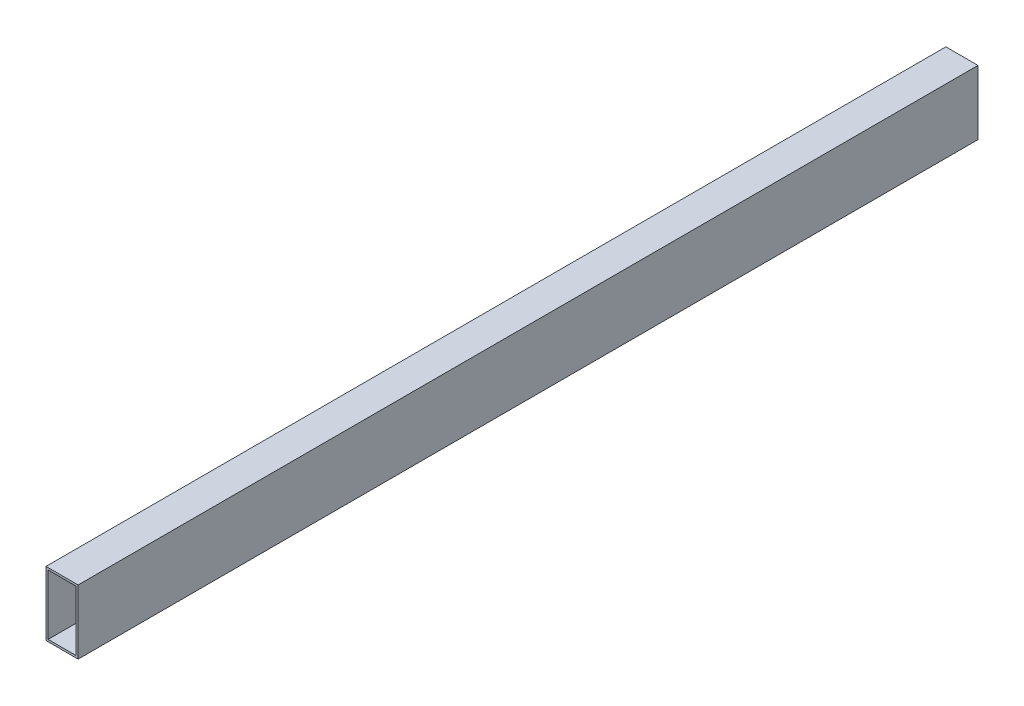
from build123d import *

# Parameters (mm, degrees)
SKETCH1_W           = 25.4
SKETCH1_H           = 50.8
BOSS_EXTRUDE1_DEPTH = 711.2
SKETCH2_W           = 22.098
SKETCH2_H           = 47.498
CUT_EXTRUDE1_DEPTH  = 714.486936201


with BuildPart() as part:
    # Sketch1 → Boss-Extrude1 (new body)
    with BuildSketch(Plane.XY):
        with Locations((-35.737209302, -4.799418605)):
            Rectangle(SKETCH1_W, SKETCH1_H)
    extrude(amount=BOSS_EXTRUDE1_DEPTH)

    # Sketch2 → Cut-Extrude1 (cut, through all)
    with BuildSketch(Plane.XY.offset(711.2)):
        with Locations((-35.737209302, -4.799418605)):
            Rectangle(SKETCH2_W, SKETCH2_H)
    extrude(amount=-CUT_EXTRUDE1_DEPTH, mode=Mode.SUBTRACT)


solid = part.part
